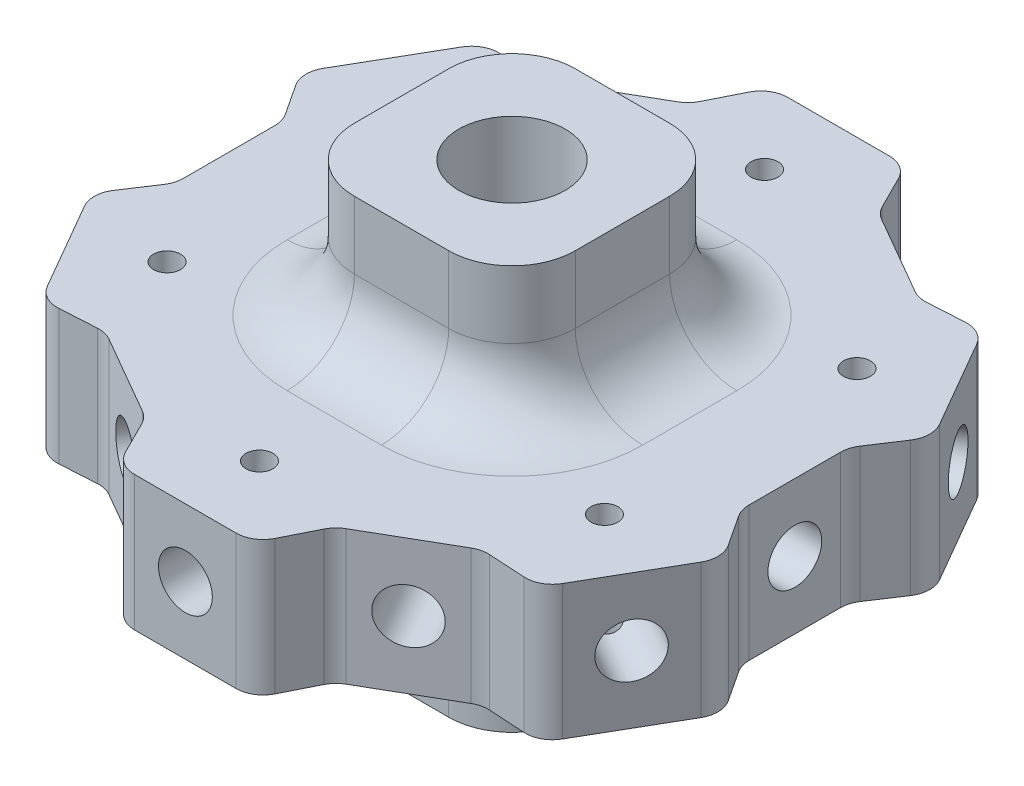
from build123d import *

# Parameters (mm, degrees)
BOSS_EXTRUDE1_DEPTH      = 5
BOSS_EXTRUDE2_DEPTH      = 15
BOSS_EXTRUDE2_DEPTH_BACK = 15
SKETCH5_W                = 16.4
SKETCH5_H                = 16.4
SKETCH5_R                = 5.04
FILLET1_R                = 2
FILLET2_R                = 4.7
FILLET3_R                = 5
SKETCH2_R                = 1
CUT_EXTRUDE1_DEPTH       = 40.039197816
SKETCH3_R                = 2
CUT_EXTRUDE2_DEPTH       = 5.5
SKETCH4_R                = 2
CUT_EXTRUDE3_DEPTH       = 13
CIRPATTERN4_COUNT        = 6
CUT_EXTRUDE4_REACH       = 44.591
CUT_EXTRUDE4_END_RADIUS  = 5.04
SKETCH6_R                = 2.25
SKETCH7_R                = 3.5
CUT_EXTRUDE5_DEPTH       = 43.591066852
CIRPATTERN5_COUNT        = 2
CIRPATTERN5_ANGLE        = 90
BOSS_EXTRUDE3_START      = -10
SKETCH8_R                = 5.04
SKETCH8_R_2              = 3.95
BOSS_EXTRUDE3_DEPTH      = 10


with BuildPart() as part:
    # Sketch1 → Boss-Extrude1 (new, symmetric)
    with BuildSketch(Plane(origin=(0, 0, 0), x_dir=(1, 0, 0), z_dir=(0, 1, 0))):
        Polygon((-5, 24.25), (5, 24.25), (7.035898385, 20.186533479), (13.964101615, 16.186533479), (18.501116042, 16.455127019), (23.501116042, 7.794872981), (21, 4), (21, -4), (23.501116042, -7.794872981), (18.501116042, -16.455127019), (13.964101615, -16.186533479), (7.035898385, -20.186533479), (5, -24.25), (-5, -24.25), (-7.035898385, -20.186533479), (-13.964101615, -16.186533479), (-18.501116042, -16.455127019), (-23.501116042, -7.794872981), (-21, -4), (-21, 4), (-23.501116042, 7.794872981), (-18.501116042, 16.455127019), (-13.964101615, 16.186533479), (-7.035898385, 20.186533479), align=None)
    extrude(amount=BOSS_EXTRUDE1_DEPTH, both=True)

    # Sketch5 → Boss-Extrude2 (add, two sides: drawn at the far end of the back side and taken through both)
    with BuildSketch(Plane(origin=(0, 0, 0), x_dir=(1, 0, 0), z_dir=(0, 1, 0)).offset(-BOSS_EXTRUDE2_DEPTH_BACK)):
        Rectangle(SKETCH5_W, SKETCH5_H)
        with Locations(Location((0, 0, 0), (0, 0, 90))):
            Circle(SKETCH5_R, mode=Mode.SUBTRACT)
    extrude(amount=BOSS_EXTRUDE2_DEPTH + BOSS_EXTRUDE2_DEPTH_BACK)

    # Fillet1
    fillet1_edges = [part.edges().sort_by_distance(p)[0] for p in [
        (-5, 0, -24.25),
        (5, 0, -24.25),
        (7.035898385, 0, -20.186533479),
        (13.964101615, 0, -16.186533479),
        (18.501116042, 0, -16.455127019),
        (23.501116042, 0, -7.794872981),
        (21, 0, -4),
        (21, 0, 4),
        (23.501116042, 0, 7.794872981),
        (18.501116042, 0, 16.455127019),
        (13.964101615, 0, 16.186533479),
        (7.035898385, 0, 20.186533479),
        (5, 0, 24.25),
        (-5, 0, 24.25),
        (-7.035898385, 0, 20.186533479),
        (-13.964101615, 0, 16.186533479),
        (-18.501116042, 0, 16.455127019),
        (-23.501116042, 0, 7.794872981),
        (-21, 0, 4),
        (-21, 0, -4),
        (-23.501116042, 0, -7.794872981),
        (-18.501116042, 0, -16.455127019),
        (-13.964101615, 0, -16.186533479),
        (-7.035898385, 0, -20.186533479),
    ]]
    fillet(fillet1_edges, radius=FILLET1_R)

    # Fillet2
    fillet2_edges = [part.edges().sort_by_distance(p)[0] for p in [
        (8.2, 10, 8.2),
        (8.2, 10, -8.2),
        (-8.2, 10, -8.2),
        (-8.2, 10, 8.2),
        (8.2, -10, 8.2),
        (8.2, -10, -8.2),
        (-8.2, -10, -8.2),
        (-8.2, -10, 8.2),
    ]]
    fillet(fillet2_edges, radius=FILLET2_R)

    # Fillet3
    fillet3_edges = [part.edges().sort_by_distance(p)[0] for p in [
        (0, 5, -8.2),
        (8.2, 5, 0),
        (0, 5, 8.2),
        (-8.2, 5, 0),
        (-8.2, -5, 0),
        (0, -5, -8.2),
        (8.2, -5, 0),
        (0, -5, 8.2),
        (6.823401872, 5, -6.823401872),
        (6.823401872, 5, 6.823401872),
        (-6.823401872, 5, -6.823401872),
        (-6.823401872, 5, 6.823401872),
        (-6.823401872, -5, -6.823401872),
        (6.823401872, -5, -6.823401872),
        (6.823401872, -5, 6.823401872),
        (-6.823401872, -5, 6.823401872),
    ]]
    fillet(fillet3_edges, radius=FILLET3_R)

    # Sketch2 → Cut-Extrude1 (cut, through all)
    with BuildSketch(Plane(origin=(0, 5, 0), x_dir=(1, 0, 0), z_dir=(0, 1, 0))):
        with Locations(Location((0, 18.75, 0), (0, 0, 270))):
            Circle(SKETCH2_R)
        with Locations(Location((16.237976321, 9.375, 0), (0, 0, 270))):
            Circle(SKETCH2_R)
        with Locations(Location((16.237976321, -9.375, 0), (0, 0, 270))):
            Circle(SKETCH2_R)
        with Locations(Location((0, -18.75, 0), (0, 0, 270))):
            Circle(SKETCH2_R)
        with Locations(Location((-16.237976321, -9.375, 0), (0, 0, 270))):
            Circle(SKETCH2_R)
        with Locations(Location((-16.237976321, 9.375, 0), (0, 0, 270))):
            Circle(SKETCH2_R)
    extrude(amount=-CUT_EXTRUDE1_DEPTH, mode=Mode.SUBTRACT)

    # Sketch3 → Cut-Extrude2 (cut)
    with BuildSketch(Plane(origin=(0, 0, -24.25), x_dir=(-1, 0, 0), z_dir=(0, 0, -1))):
        Circle(SKETCH3_R)
    cut_extrude2 = extrude(amount=-CUT_EXTRUDE2_DEPTH, mode=Mode.SUBTRACT)

    # Sketch4 → Cut-Extrude3 (cut)
    with BuildSketch(Plane(origin=(10.5, 0, -18.186533479), x_dir=(-0.8660254037844383, 0, -0.5000000000000009), z_dir=(0.5000000000000008, 0, -0.8660254037844382))):
        Circle(SKETCH4_R)
    cut_extrude3 = extrude(amount=-CUT_EXTRUDE3_DEPTH, mode=Mode.SUBTRACT)

    # CirPattern4: Cut-Extrude2, Cut-Extrude3 ×6 about axis
    cirpattern4_axis = Axis((0, 0, 0), (0, 1, 0))
    add([cut_extrude2.rotate(cirpattern4_axis, i * 360 / CIRPATTERN4_COUNT) for i in range(1, CIRPATTERN4_COUNT)], mode=Mode.SUBTRACT)
    add([cut_extrude3.rotate(cirpattern4_axis, i * 360 / CIRPATTERN4_COUNT) for i in range(1, CIRPATTERN4_COUNT)], mode=Mode.SUBTRACT)

    # Cut-Extrude4: up to this cylinder (the profile starts outside it)
    cut_extrude4_end = Plane(origin=(0, -10, 0), z_dir=(0, -1, 0)) * Cylinder(CUT_EXTRUDE4_END_RADIUS, 100.262, mode=Mode.PRIVATE)
    # Sketch6 → Cut-Extrude4 (cut, up to the surface)
    with BuildSketch(Plane.XY.offset(8.2), mode=Mode.PRIVATE) as cut_extrude4_sk1:
        with Locations((0, -10)):
            Circle(SKETCH6_R)
    cut_extrude4_tool1 = extrude(cut_extrude4_sk1.sketch, amount=-CUT_EXTRUDE4_REACH, mode=Mode.PRIVATE) - cut_extrude4_end
    cut_extrude4 = cut_extrude4_tool1.solids().sort_by_distance((0, -10, 8.2))[0]
    add(cut_extrude4, mode=Mode.SUBTRACT)

    # Sketch7 → Cut-Extrude5 (cut, through all)
    with BuildSketch(Plane.XY.offset(8.2)):
        with Locations((0, -10)):
            Circle(SKETCH7_R)
    cut_extrude5 = extrude(amount=CUT_EXTRUDE5_DEPTH, mode=Mode.SUBTRACT)

    # CirPattern5: Cut-Extrude4, Cut-Extrude5 ×2 about axis
    cirpattern5_axis = Axis((0, 60, 0), (0, -1, 0))
    add([cut_extrude4.rotate(cirpattern5_axis, i * CIRPATTERN5_ANGLE / (CIRPATTERN5_COUNT - 1)) for i in range(1, CIRPATTERN5_COUNT)], mode=Mode.SUBTRACT)
    add([cut_extrude5.rotate(cirpattern5_axis, i * CIRPATTERN5_ANGLE / (CIRPATTERN5_COUNT - 1)) for i in range(1, CIRPATTERN5_COUNT)], mode=Mode.SUBTRACT)

    # Sketch8 → Boss-Extrude3 (add)
    with BuildSketch(Plane(origin=(0, 15, 0), x_dir=(1, 0, 0), z_dir=(0, 1, 0)).offset(BOSS_EXTRUDE3_START)):
        with Locations(Location((0, 0, 0), (0, 0, 90))):
            Circle(SKETCH8_R)
        with Locations(Location((0, 0, 0), (0, 0, 270))):
            Circle(SKETCH8_R_2, mode=Mode.SUBTRACT)
    extrude(amount=BOSS_EXTRUDE3_DEPTH)


solid = part.part
